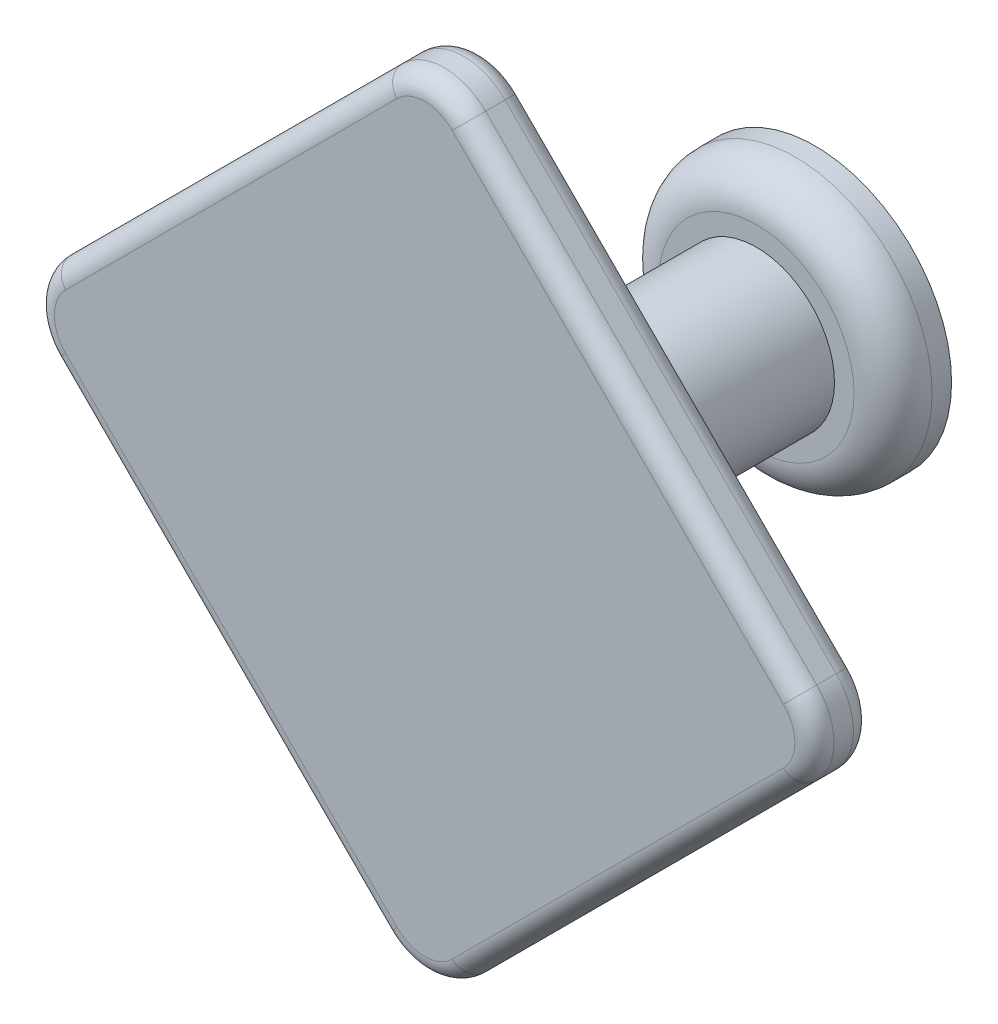
from build123d import *

# Parameters (mm, degrees)
BOSS_EXTRUDE1_DEPTH = 1.5
FILLET1_R           = 3
FILLET3_R           = 1
BOSS_EXTRUDE2_START = -1.5
SKETCH1_3_R         = 4
SKETCH1_3_R_2       = 2.5
BOSS_EXTRUDE2_DEPTH = 17
BOSS_EXTRUDE3_START = -15.5
SKETCH1_4_R         = 7
SKETCH1_4_R_2       = 4
BOSS_EXTRUDE3_DEPTH = 3
FILLET4_R           = 2


with BuildPart() as part:
    # Sketch1 → Boss-Extrude1 (new, symmetric)
    with BuildSketch(Plane.XY):
        Polygon((-21.213203436, 0), (0, 21.213203436), (21.213203436, 0), (0, -21.213203436), align=None)
    extrude(amount=BOSS_EXTRUDE1_DEPTH, both=True)

    # Fillet1
    fillet1_edges = [part.edges().sort_by_distance(p)[0] for p in [
        (-21.213203436, 0, 0),
        (0, 21.213203436, 0),
        (21.213203436, 0, 0),
        (0, -21.213203436, 0),
    ]]
    fillet(fillet1_edges, radius=FILLET1_R)

    # Fillet3
    fillet3_edges = [part.edges().sort_by_distance(p)[0] for p in [
        (-10.606601718, -10.606601718, -1.5),
        (-10.606601718, -10.606601718, 1.5),
        (-10.606601718, 10.606601718, -1.5),
        (10.606601718, 10.606601718, -1.5),
        (10.606601718, -10.606601718, -1.5),
        (0, 19.970562748, -1.5),
        (0, -19.970562748, -1.5),
        (19.970562748, 0, -1.5),
        (-19.970562748, 0, -1.5),
        (-10.606601718, 10.606601718, 1.5),
        (10.606601718, -10.606601718, 1.5),
        (10.606601718, 10.606601718, 1.5),
        (0, 19.970562748, 1.5),
        (0, -19.970562748, 1.5),
        (19.970562748, 0, 1.5),
        (-19.970562748, 0, 1.5),
    ]]
    fillet(fillet3_edges, radius=FILLET3_R)

    # Sketch1<3> → Boss-Extrude2 (add)
    with BuildSketch(Plane.XY.offset(BOSS_EXTRUDE2_START)):
        Circle(SKETCH1_3_R)
        Circle(SKETCH1_3_R_2, mode=Mode.SUBTRACT)
    extrude(amount=-BOSS_EXTRUDE2_DEPTH)

    # Sketch1<4> → Boss-Extrude3 (add)
    with BuildSketch(Plane.XY.offset(BOSS_EXTRUDE3_START)):
        Circle(SKETCH1_4_R)
        Circle(SKETCH1_4_R_2, mode=Mode.SUBTRACT)
    extrude(amount=-BOSS_EXTRUDE3_DEPTH)

    # Fillet4
    fillet4_edges = [part.edges().sort_by_distance(p)[0] for p in [
        (-7, 0, -15.5),
    ]]
    fillet(fillet4_edges, radius=FILLET4_R)


solid = part.part
